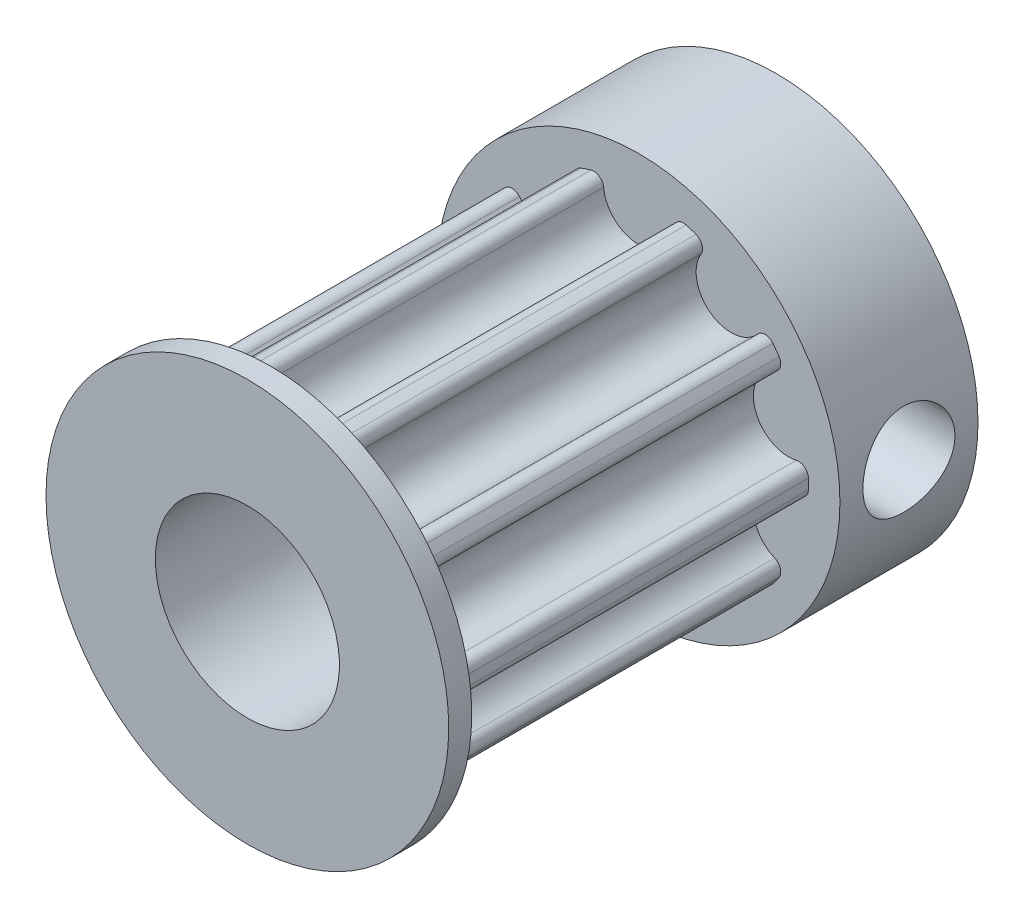
from build123d import *

# Parameters (mm, degrees)
BOSS_EXTRUDE1_DEPTH = 16
SKETCH2_R           = 8.75
BOSS_EXTRUDE2_DEPTH = 1
BOSS_EXTRUDE3_START = 6
SKETCH3_R           = 8.75
BOSS_EXTRUDE3_DEPTH = 6
SKETCH4_R           = 4
CUT_EXTRUDE1_DEPTH  = 27.117522853
SKETCH5_R           = 2
CUT_EXTRUDE2_DEPTH  = 22.026768653
CIRPATTERN1_COUNT   = 2
CIRPATTERN1_ANGLE   = 90


with BuildPart() as part:
    # Sketch1 → Boss-Extrude1 (new body)
    with BuildSketch(Plane.XY):
        with BuildLine():
            ThreePointArc((0, 5.325), (1.029470644, 5.724915472), (1.519005236, 6.7149145))
            ThreePointArc((1.519005236, 6.7149145), (1.704817188, 7.031923192), (2.067709649, 7.089626352))
            ThreePointArc((2.067709649, 7.089626352), (2.282090503, 7.023552373), (2.494365569, 6.95099744))
            ThreePointArc((2.494365569, 6.95099744), (2.75403467, 6.691011766), (2.718026663, 6.325328822))
            ThreePointArc((2.718026663, 6.325328822), (2.53216164, 5.236661571), (3.129956468, 4.308015495))
            ThreePointArc((3.129956468, 4.308015495), (4.197880131, 4.026446247), (5.175828764, 4.53963107))
            ThreePointArc((5.175828764, 4.53963107), (5.512486825, 4.686878964), (5.839990059, 4.520258965))
            ThreePointArc((5.839990059, 4.520258965), (5.974590503, 4.340794088), (6.103677919, 4.157323762))
            ThreePointArc((6.103677919, 4.157323762), (6.16093889, 3.794361265), (5.916864759, 3.519682524))
            ThreePointArc((5.916864759, 3.519682524), (5.126594241, 2.748180936), (5.064375949, 1.645515495))
            ThreePointArc((5.064375949, 1.645515495), (5.762842089, 0.790011408), (6.855661624, 0.630362868))
            ThreePointArc((6.855661624, 0.630362868), (7.214573857, 0.551606273), (7.381592761, 0.224306291))
            ThreePointArc((7.381592761, 0.224306291), (7.385, 0), (7.381592761, -0.224306291))
            ThreePointArc((7.381592761, -0.224306291), (7.214573857, -0.551606273), (6.855661624, -0.630362868))
            ThreePointArc((6.855661624, -0.630362868), (5.762842089, -0.790011408), (5.064375949, -1.645515495))
            ThreePointArc((5.064375949, -1.645515495), (5.126594241, -2.748180936), (5.916864759, -3.519682524))
            ThreePointArc((5.916864759, -3.519682524), (6.16093889, -3.794361265), (6.103677919, -4.157323762))
            ThreePointArc((6.103677919, -4.157323762), (5.974590503, -4.340794088), (5.839990059, -4.520258965))
            ThreePointArc((5.839990059, -4.520258965), (5.512486825, -4.686878964), (5.175828764, -4.53963107))
            ThreePointArc((5.175828764, -4.53963107), (4.197880131, -4.026446247), (3.129956468, -4.308015495))
            ThreePointArc((3.129956468, -4.308015495), (2.532161639, -5.236661571), (2.718026663, -6.325328822))
            ThreePointArc((2.718026663, -6.325328822), (2.75403467, -6.691011766), (2.494365569, -6.95099744))
            ThreePointArc((2.494365569, -6.95099744), (2.282090503, -7.023552373), (2.067709649, -7.089626352))
            ThreePointArc((2.067709649, -7.089626352), (1.704817188, -7.031923192), (1.519005236, -6.7149145))
            ThreePointArc((1.519005236, -6.7149145), (1.029470644, -5.724915472), (0, -5.325))
            ThreePointArc((0, -5.325), (-1.029470644, -5.724915472), (-1.519005236, -6.7149145))
            ThreePointArc((-1.519005236, -6.7149145), (-1.704817188, -7.031923192), (-2.067709649, -7.089626352))
            ThreePointArc((-2.067709649, -7.089626352), (-2.282090503, -7.023552373), (-2.494365569, -6.95099744))
            ThreePointArc((-2.494365569, -6.95099744), (-2.75403467, -6.691011766), (-2.718026663, -6.325328822))
            ThreePointArc((-2.718026663, -6.325328822), (-2.53216164, -5.236661571), (-3.129956468, -4.308015495))
            ThreePointArc((-3.129956468, -4.308015495), (-4.197880131, -4.026446247), (-5.175828764, -4.53963107))
            ThreePointArc((-5.175828764, -4.53963107), (-5.512486825, -4.686878964), (-5.839990059, -4.520258965))
            ThreePointArc((-5.839990059, -4.520258965), (-5.974590503, -4.340794088), (-6.103677919, -4.157323762))
            ThreePointArc((-6.103677919, -4.157323762), (-6.16093889, -3.794361265), (-5.916864759, -3.519682524))
            ThreePointArc((-5.916864759, -3.519682524), (-5.126594241, -2.748180936), (-5.064375949, -1.645515495))
            ThreePointArc((-5.064375949, -1.645515495), (-5.762842089, -0.790011408), (-6.855661624, -0.630362868))
            ThreePointArc((-6.855661624, -0.630362868), (-7.214573857, -0.551606273), (-7.381592761, -0.224306291))
            ThreePointArc((-7.381592761, -0.224306291), (-7.385, 0), (-7.381592761, 0.224306291))
            ThreePointArc((-7.381592761, 0.224306291), (-7.214573857, 0.551606273), (-6.855661624, 0.630362868))
            ThreePointArc((-6.855661624, 0.630362868), (-5.762842089, 0.790011408), (-5.064375949, 1.645515495))
            ThreePointArc((-5.064375949, 1.645515495), (-5.126594241, 2.748180936), (-5.916864759, 3.519682524))
            ThreePointArc((-5.916864759, 3.519682524), (-6.16093889, 3.794361265), (-6.103677919, 4.157323762))
            ThreePointArc((-6.103677919, 4.157323762), (-5.974590503, 4.340794088), (-5.839990059, 4.520258965))
            ThreePointArc((-5.839990059, 4.520258965), (-5.512486825, 4.686878964), (-5.175828764, 4.53963107))
            ThreePointArc((-5.175828764, 4.53963107), (-4.197880131, 4.026446247), (-3.129956468, 4.308015495))
            ThreePointArc((-3.129956468, 4.308015495), (-2.532161639, 5.236661571), (-2.718026663, 6.325328822))
            ThreePointArc((-2.718026663, 6.325328822), (-2.75403467, 6.691011766), (-2.494365569, 6.95099744))
            ThreePointArc((-2.494365569, 6.95099744), (-2.282090503, 7.023552373), (-2.067709649, 7.089626352))
            ThreePointArc((-2.067709649, 7.089626352), (-1.704817188, 7.031923192), (-1.519005236, 6.7149145))
            ThreePointArc((-1.519005236, 6.7149145), (-1.029470644, 5.724915472), (0, 5.325))
        make_face()
    extrude(amount=BOSS_EXTRUDE1_DEPTH)

    # Sketch2 → Boss-Extrude2 (add)
    with BuildSketch(Plane.XY.offset(16)):
        Circle(SKETCH2_R)
    extrude(amount=BOSS_EXTRUDE2_DEPTH)

    # Sketch3 → Boss-Extrude3 (add)
    with BuildSketch(Plane(origin=(0, 0, 0), x_dir=(-1, 0, 0), z_dir=(0, 0, -1)).offset(BOSS_EXTRUDE3_START)):
        with Locations(Location((0, 0, 0), (0, 0, 180))):
            Circle(SKETCH3_R)
    extrude(amount=-BOSS_EXTRUDE3_DEPTH)

    # Sketch4 → Cut-Extrude1 (cut, through all)
    with BuildSketch(Plane(origin=(0, 0, -6), x_dir=(-1, 0, 0), z_dir=(0, 0, -1))):
        Circle(SKETCH4_R)
    extrude(amount=-CUT_EXTRUDE1_DEPTH, mode=Mode.SUBTRACT)

    # Sketch5 → Cut-Extrude2 (cut, through all)
    with BuildSketch(Plane(origin=(0, 0, 0), x_dir=(1, 0, 0), z_dir=(0, 1, 0))):
        with Locations(Location((0, 3, 0), (0, 0, 270))):
            Circle(SKETCH5_R)
    cut_extrude2 = extrude(amount=-CUT_EXTRUDE2_DEPTH, mode=Mode.SUBTRACT)

    # CirPattern1: Cut-Extrude2 ×2 about axis
    cirpattern1_axis = Axis((0, 0, 16), (0, 0, 1))
    for i in range(1, CIRPATTERN1_COUNT):
        add(cut_extrude2.rotate(cirpattern1_axis, i * CIRPATTERN1_ANGLE / (CIRPATTERN1_COUNT - 1)), mode=Mode.SUBTRACT)


solid = part.part
